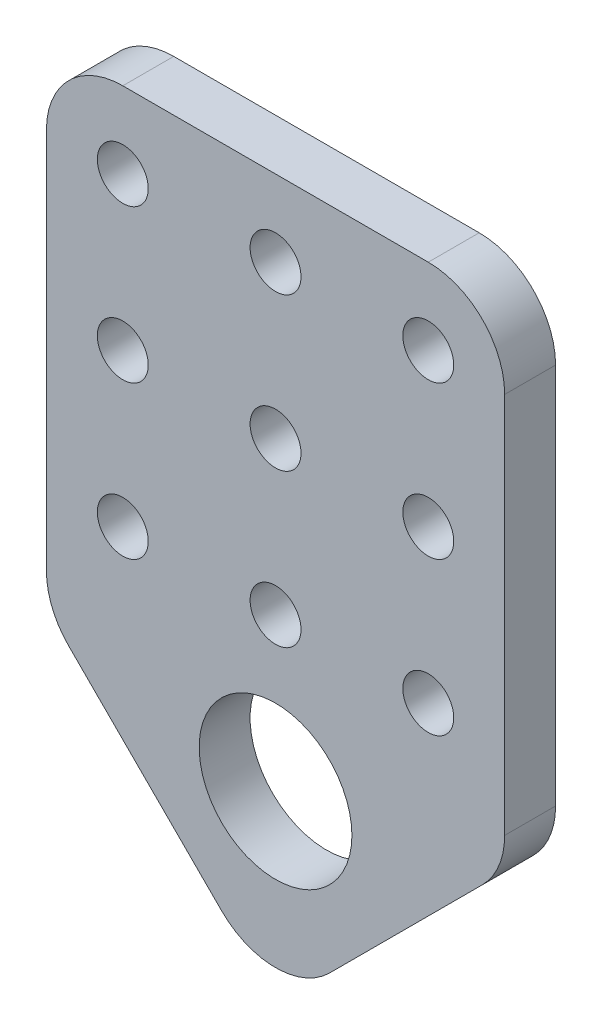
from build123d import *

# Parameters (mm, degrees)
MODEL_R                 = 1.5
MODEL_R_2               = 4.5
SALIENTE_EXTRUIR1_DEPTH = 3


with BuildPart() as part:
    # Model → Saliente-Extruir1 (new body)
    with BuildSketch(Plane.XY):
        with BuildLine():
            Line((174.227054575, 222.178720063), (174.227054575, 213.178720063))
            Line((174.227054575, 213.178720063), (174.227054575, 199.678720063))
            ThreePointArc((174.227054575, 199.678720063), (174.569596678, 197.956644617), (175.545074059, 196.496739548))
            Line((175.545074059, 196.496739548), (184.545074059, 187.496739548))
            ThreePointArc((184.545074059, 187.496739548), (187.727054575, 186.178720063), (190.90903509, 187.496739548))
            Line((190.90903509, 187.496739548), (199.90903509, 196.496739548))
            ThreePointArc((199.90903509, 196.496739548), (200.884512471, 197.956644617), (201.227054575, 199.678720063))
            Line((201.227054575, 199.678720063), (201.227054575, 222.178720063))
            ThreePointArc((201.227054575, 222.178720063), (199.90903509, 225.360700578), (196.727054575, 226.678720063))
            Line((196.727054575, 226.678720063), (178.727054575, 226.678720063))
            ThreePointArc((178.727054575, 226.678720063), (175.545074059, 225.360700578), (174.227054575, 222.178720063))
        make_face()
        with Locations((178.727054575, 204.178720063)):
            Circle(MODEL_R, mode=Mode.SUBTRACT)
        with Locations((187.727054575, 195.178720063)):
            Circle(MODEL_R_2, mode=Mode.SUBTRACT)
        with Locations((187.727054575, 204.178720063)):
            Circle(MODEL_R, mode=Mode.SUBTRACT)
        with Locations((196.727054575, 204.178720063)):
            Circle(MODEL_R, mode=Mode.SUBTRACT)
        with Locations((178.727054575, 213.178720063)):
            Circle(MODEL_R, mode=Mode.SUBTRACT)
        with Locations((178.727054575, 222.178720063)):
            Circle(MODEL_R, mode=Mode.SUBTRACT)
        with Locations((187.727054575, 213.178720063)):
            Circle(MODEL_R, mode=Mode.SUBTRACT)
        with Locations((196.727054575, 213.178720063)):
            Circle(MODEL_R, mode=Mode.SUBTRACT)
        with Locations((187.727054575, 222.178720063)):
            Circle(MODEL_R, mode=Mode.SUBTRACT)
        with Locations((196.727054575, 222.178720063)):
            Circle(MODEL_R, mode=Mode.SUBTRACT)
    extrude(amount=SALIENTE_EXTRUIR1_DEPTH)


solid = part.part
